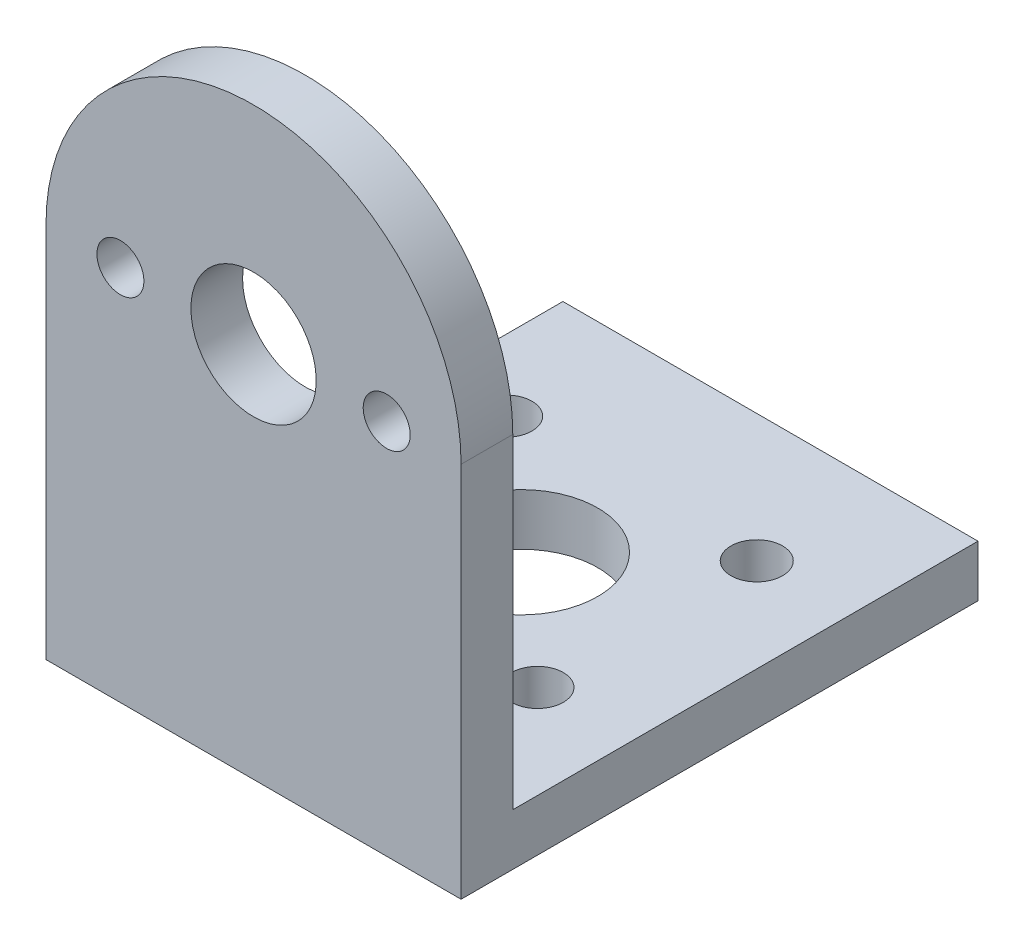
from build123d import *

# Parameters (mm, degrees)
SKETCH_1_W          = 26.5
SKETCH_1_H          = 33
SKETCH_1_R          = 4.9
SKETCH_1_R_2        = 1.65
EXTRUDE_1_DEPTH     = 3.3
SKETCH_2_W          = 26.5
SKETCH_2_H          = 3.3
EXTRUDE_2_DEPTH     = 34
CUT_EXTRUDE_3_DEPTH = 34
SKETCH_4_R          = 4
SKETCH_4_R_2        = 1.5
CUT_EXTRUDE_4_DEPTH = 34


with BuildPart() as part:
    # 草图1 → 凸台-拉伸1 (new body)
    with BuildSketch(Plane(origin=(0, 0, 0), x_dir=(1, 0, 0), z_dir=(0, 1, 0))):
        with Locations((13.25, 16.5)):
            Rectangle(SKETCH_1_W, SKETCH_1_H)
        with Locations(Location((12.525580031, 17.8, 0), (0, 0, 270))):
            Circle(SKETCH_1_R, mode=Mode.SUBTRACT)
        with Locations(Location((4.525580031, 24.85, 0), (0, 0, 270))):
            Circle(SKETCH_1_R_2, mode=Mode.SUBTRACT)
        with Locations(Location((20.525580031, 24.85, 0), (0, 0, 90))):
            Circle(SKETCH_1_R_2, mode=Mode.SUBTRACT)
        with Locations(Location((4.525580031, 10.85, 0), (0, 0, 270))):
            Circle(SKETCH_1_R_2, mode=Mode.SUBTRACT)
        with Locations(Location((20.525580031, 10.85, 0), (0, 0, 270))):
            Circle(SKETCH_1_R_2, mode=Mode.SUBTRACT)
    extrude(amount=EXTRUDE_1_DEPTH)

    # 草图2 → 凸台-拉伸2 (add)
    with BuildSketch(Plane(origin=(0, 3.3, 0), x_dir=(1, 0, 0), z_dir=(0, 1, 0))):
        with Locations((13.25, 1.65)):
            Rectangle(SKETCH_2_W, SKETCH_2_H)
    extrude(amount=EXTRUDE_2_DEPTH)

    # 草图3 → 切除-拉伸3 (cut)
    with BuildSketch(Plane(origin=(0, 0, -3.3), x_dir=(-1, 0, 0), z_dir=(0, 0, -1))):
        with BuildLine():
            Line((-26.5, 37.3), (-26.5, 24.05))
            ThreePointArc((-26.5, 24.05), (-22.619164851, 33.419164851), (-13.25, 37.3))
            Line((-13.25, 37.3), (-26.5, 37.3))
        make_face()
        with BuildLine():
            ThreePointArc((-13.25, 37.3), (-3.880835149, 33.419164851), (0, 24.05))
            Line((0, 24.05), (0, 37.3))
            Line((0, 37.3), (-13.25, 37.3))
        make_face()
    extrude(amount=-CUT_EXTRUDE_3_DEPTH, mode=Mode.SUBTRACT)

    # 草图4 → 切除-拉伸4 (cut)
    with BuildSketch(Plane(origin=(0, 0, -3.3), x_dir=(-1, 0, 0), z_dir=(0, 0, -1))):
        with Locations((-13.25, 24.05)):
            Circle(SKETCH_4_R)
        with Locations((-4.75, 24.05)):
            Circle(SKETCH_4_R_2)
        with Locations((-21.75, 24.05)):
            Circle(SKETCH_4_R_2)
    extrude(amount=-CUT_EXTRUDE_4_DEPTH, mode=Mode.SUBTRACT)


solid = part.part
